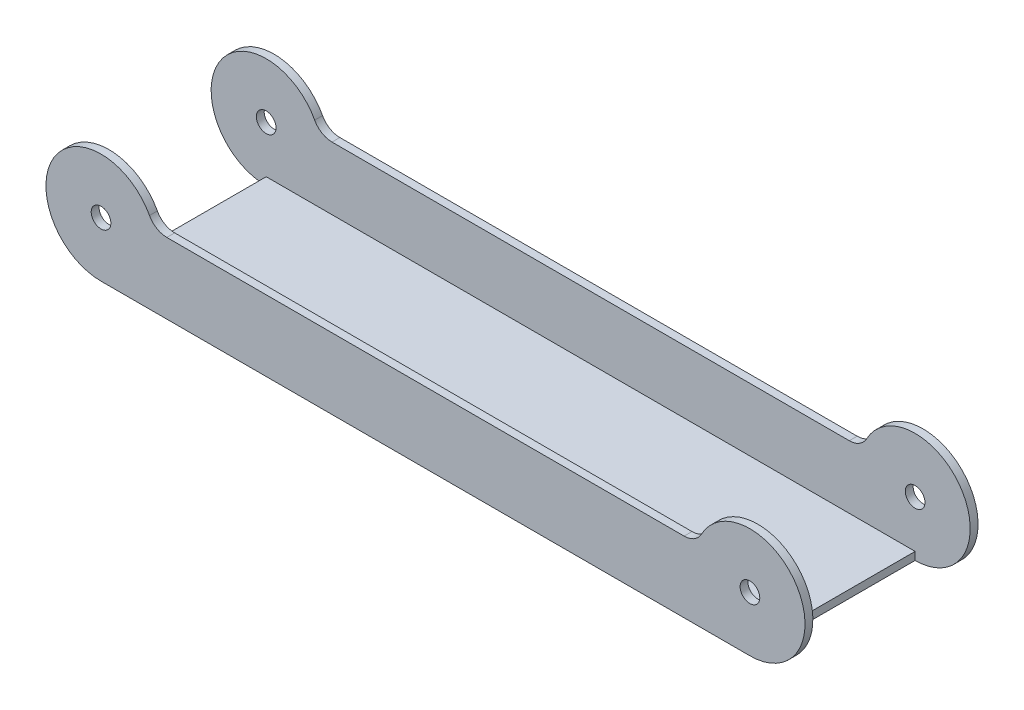
from build123d import *

# Parameters (mm, degrees)
SKETCH2_W                      = 195
SKETCH2_H                      = 44
BOSS_EXTRUDE1_DEPTH            = 14
SHELL1_T                       = -2
SKETCH3_R                      = 2.5
CUT_EXTRUDE1_DEPTH             = 108.880721169
CUT_EXTRUDE2_REACH             = 196.754
SKETCH4_W                      = 40
SKETCH4_H                      = 26
CUT_EXTRUDE2_DIRECTION_2_REACH = 196.754
CUT_EXTRUDE3_DEPTH             = 101.926953783
CUT_EXTRUDE3_DEPTH_BACK        = 101.926953783
CUT_EXTRUDE4_REACH             = 104.86
SKETCH7_W                      = 7.211102551
SKETCH7_H                      = 40
FILLET1_R                      = 5


with BuildPart() as part:
    # Sketch2 → Boss-Extrude1 (new, symmetric)
    with BuildSketch(Plane(origin=(0, 0, 0), x_dir=(1, 0, 0), z_dir=(0, 1, 0))):
        Rectangle(SKETCH2_W, SKETCH2_H)
    extrude(amount=BOSS_EXTRUDE1_DEPTH, both=True)

    # Shell1
    shell1_openings = [part.faces().sort_by_distance(p)[0] for p in [
        (0, 14, 0),
    ]]
    offset(amount=SHELL1_T, openings=shell1_openings, kind=Kind.INTERSECTION)

    # Sketch3 → Cut-Extrude1 (cut, through all)
    with BuildSketch(Plane.XY.offset(22)):
        with Locations((-82.5, 0)):
            Circle(SKETCH3_R)
        with Locations((82.5, 0)):
            Circle(SKETCH3_R)
    extrude(amount=-CUT_EXTRUDE1_DEPTH, mode=Mode.SUBTRACT)

    # Sketch4 → Cut-Extrude2 (cut, up to next)
    with BuildSketch(Plane(origin=(-95.5, 0, 0), x_dir=(0, 0, -1), z_dir=(1, 0, 0)), mode=Mode.PRIVATE) as cut_extrude2_sk1:
        with Locations((0, 1)):
            Rectangle(SKETCH4_W, SKETCH4_H)
    cut_extrude2_tool1 = extrude(cut_extrude2_sk1.sketch, amount=-CUT_EXTRUDE2_REACH, mode=Mode.PRIVATE) & part.part
    add(cut_extrude2_tool1.solids().sort_by_distance((-95.5, 1, 0))[0], mode=Mode.SUBTRACT)

    # Sketch4 → Cut-Extrude2 direction 2 (cut, up to next)
    with BuildSketch(Plane(origin=(-95.5, 0, 0), x_dir=(0, 0, -1), z_dir=(1, 0, 0)), mode=Mode.PRIVATE) as cut_extrude2_direction_2_sk1:
        with Locations((0, 1)):
            Rectangle(SKETCH4_W, SKETCH4_H)
    cut_extrude2_direction_2_tool1 = extrude(cut_extrude2_direction_2_sk1.sketch, amount=CUT_EXTRUDE2_DIRECTION_2_REACH, mode=Mode.PRIVATE) & part.part
    add(cut_extrude2_direction_2_tool1.solids().sort_by_distance((-95.5, 1, 0))[0], mode=Mode.SUBTRACT)

    # Sketch6 → Cut-Extrude3 (cut, two sides: drawn at the far end of the back side and taken through both)
    with BuildSketch(Plane.XY.offset(-CUT_EXTRUDE3_DEPTH_BACK)):
        with BuildLine():
            Line((-69.083592135, 4), (69.083592135, 4))
            ThreePointArc((69.083592135, 4), (93.72497216, 8.366600265), (82.5, -14))
            Line((82.5, -14), (97.5, -14))
            Line((97.5, -14), (97.5, 24))
            Line((97.5, 24), (-97.5, 24))
            Line((-97.5, 24), (-97.5, -14))
            Line((-97.5, -14), (-82.5, -14))
            ThreePointArc((-82.5, -14), (-93.72497216, 8.366600265), (-69.083592135, 4))
        make_face()
    extrude(amount=CUT_EXTRUDE3_DEPTH + CUT_EXTRUDE3_DEPTH_BACK, mode=Mode.SUBTRACT)

    # Sketch7 → Cut-Extrude4 (cut, up to next)
    with BuildSketch(Plane.XZ.offset(14), mode=Mode.PRIVATE) as cut_extrude4_sk1:
        with Locations((86.105551276, 0)):
            Rectangle(SKETCH7_W, SKETCH7_H)
    cut_extrude4_tool1 = extrude(cut_extrude4_sk1.sketch, amount=-CUT_EXTRUDE4_REACH, mode=Mode.PRIVATE) & part.part
    # Sketch7 → Cut-Extrude4 (cut, up to next)
    with BuildSketch(Plane.XZ.offset(14), mode=Mode.PRIVATE) as cut_extrude4_sk2:
        with Locations((-86.105551276, 0)):
            Rectangle(SKETCH7_W, SKETCH7_H)
    cut_extrude4_tool2 = extrude(cut_extrude4_sk2.sketch, amount=-CUT_EXTRUDE4_REACH, mode=Mode.PRIVATE) & part.part
    add(cut_extrude4_tool1.solids().sort_by_distance((86.105551, -14, 0))[0], mode=Mode.SUBTRACT)
    add(cut_extrude4_tool2.solids().sort_by_distance((-86.105551, -14, 0))[0], mode=Mode.SUBTRACT)

    # Fillet1
    fillet1_edges = [part.edges().sort_by_distance(p)[0] for p in [
        (69.083592135, 4, -21),
        (-69.083592135, 4, 21),
        (-69.083592135, 4, -21),
        (69.083592135, 4, 21),
    ]]
    fillet(fillet1_edges, radius=FILLET1_R)


solid = part.part
